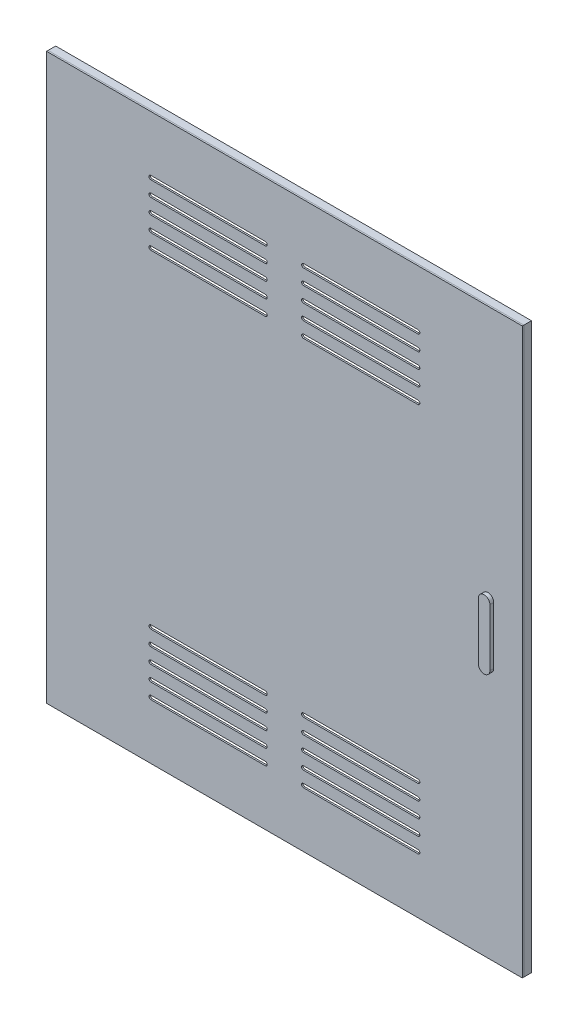
from build123d import *

# Parameters (mm, degrees)
SKETCH1_W            = 1247
SKETCH1_H            = 1480
SKETCH1_W_2          = 1207
SKETCH1_H_2          = 1440
BOSS_EXTRUDE1_DEPTH  = 20
SKETCH3_W            = 20
SKETCH3_H            = 60
BOSS_EXTRUDE2_DEPTH  = 2
SKETCH4_R            = 7
SKETCH4_R_2          = 5
BOSS_EXTRUDE3_DEPTH  = 60
SKETCH5_W            = 1247
SKETCH5_H            = 1480
BOSS_EXTRUDE4_DEPTH  = 4
BOSS_EXTRUDE5_DEPTH  = 10
CUT_EXTRUDE1_DEPTH   = 978.224257783
LPATTERN1_COUNT      = 5
LPATTERN1_PITCH      = 40
MIRROR2_COPY_1_DEPTH = 978.224257783
MIRROR2_COPY_2_DEPTH = 978.224257783
MIRROR2_COPY_3_DEPTH = 978.224257783
MIRROR2_COPY_4_DEPTH = 978.224257783


with BuildPart() as part:
    # Sketch1 → Boss-Extrude1 (new body)
    with BuildSketch(Plane.XY):
        Rectangle(SKETCH1_W, SKETCH1_H)
        Rectangle(SKETCH1_W_2, SKETCH1_H_2, mode=Mode.SUBTRACT)
    extrude(amount=BOSS_EXTRUDE1_DEPTH)

    # Sketch3 → Boss-Extrude2 (add)
    with BuildSketch(Plane.ZY.offset(623.5)):
        with Locations((10, 530)):
            Rectangle(SKETCH3_W, SKETCH3_H)
    boss_extrude2 = extrude(amount=BOSS_EXTRUDE2_DEPTH)

    # Sketch4 → Boss-Extrude3 (add)
    with BuildSketch(Plane(origin=(0, 560, 0), x_dir=(1, 0, 0), z_dir=(0, 1, 0))):
        with Locations((-630.5, 0)):
            Circle(SKETCH4_R)
        with Locations(Location((-630.5, 0, 0), (0, 0, 180))):
            Circle(SKETCH4_R_2, mode=Mode.SUBTRACT)
    boss_extrude3 = extrude(amount=-BOSS_EXTRUDE3_DEPTH)

    # Mirror1: Boss-Extrude2, Boss-Extrude3 across plane
    add(boss_extrude2.mirror(Plane.ZX))
    add(boss_extrude3.mirror(Plane.ZX))


with BuildPart() as body_2:
    # Sketch5 → Boss-Extrude4 (new body)
    with BuildSketch(Plane.XY.offset(20)):
        Rectangle(SKETCH5_W, SKETCH5_H)
    extrude(amount=BOSS_EXTRUDE4_DEPTH)

    # Sketch6 → Boss-Extrude5 (add)
    with BuildSketch(Plane.XY.offset(24)):
        with BuildLine():
            Line((548.5, 75), (548.5, -75))
            ThreePointArc((548.5, -75), (533.5, -90), (518.5, -75))
            Line((518.5, -75), (518.5, 75))
            ThreePointArc((518.5, 75), (533.5, 90), (548.5, 75))
        make_face()
    extrude(amount=BOSS_EXTRUDE5_DEPTH)

    # Sketch7 → Cut-Extrude1 (cut, through all)
    with BuildSketch(Plane.XY.offset(24)):
        with BuildLine():
            Line((-350, 595), (-50, 595))
            ThreePointArc((-50, 595), (-45, 590), (-50, 585))
            Line((-50, 585), (-350, 585))
            ThreePointArc((-350, 585), (-355, 590), (-350, 595))
        make_face()
        with BuildLine():
            Line((50, 595), (350, 595))
            ThreePointArc((350, 595), (355, 590), (350, 585))
            Line((350, 585), (50, 585))
            ThreePointArc((50, 585), (45, 590), (50, 595))
        make_face()
    cut_extrude1 = extrude(amount=-CUT_EXTRUDE1_DEPTH, mode=Mode.SUBTRACT)

    # LPattern1: Cut-Extrude1 ×5
    with Locations(*[(0, -i * LPATTERN1_PITCH, 0) for i in range(1, LPATTERN1_COUNT)]):
        add(cut_extrude1, mode=Mode.SUBTRACT)

    # Mirror2: Cut-Extrude1 across plane
    add(cut_extrude1.mirror(Plane.ZX), mode=Mode.SUBTRACT)

    # Mirror2 copy 1 sketch → Mirror2 copy 1 (cut, through all)
    with BuildSketch(Plane(origin=(0, 40, 24), x_dir=(1, 0, 0), z_dir=(0, 0, 1))):
        with BuildLine():
            Line((-350, -595), (-50, -595))
            ThreePointArc((-50, -595), (-45, -590), (-50, -585))
            Line((-50, -585), (-350, -585))
            ThreePointArc((-350, -585), (-355, -590), (-350, -595))
        make_face()
        with BuildLine():
            Line((50, -595), (350, -595))
            ThreePointArc((350, -595), (355, -590), (350, -585))
            Line((350, -585), (50, -585))
            ThreePointArc((50, -585), (45, -590), (50, -595))
        make_face()
    extrude(amount=-MIRROR2_COPY_1_DEPTH, mode=Mode.SUBTRACT)

    # Mirror2 copy 2 sketch → Mirror2 copy 2 (cut, through all)
    with BuildSketch(Plane(origin=(0, 80, 24), x_dir=(1, 0, 0), z_dir=(0, 0, 1))):
        with BuildLine():
            Line((-350, -595), (-50, -595))
            ThreePointArc((-50, -595), (-45, -590), (-50, -585))
            Line((-50, -585), (-350, -585))
            ThreePointArc((-350, -585), (-355, -590), (-350, -595))
        make_face()
        with BuildLine():
            Line((50, -595), (350, -595))
            ThreePointArc((350, -595), (355, -590), (350, -585))
            Line((350, -585), (50, -585))
            ThreePointArc((50, -585), (45, -590), (50, -595))
        make_face()
    extrude(amount=-MIRROR2_COPY_2_DEPTH, mode=Mode.SUBTRACT)

    # Mirror2 copy 3 sketch → Mirror2 copy 3 (cut, through all)
    with BuildSketch(Plane(origin=(0, 120, 24), x_dir=(1, 0, 0), z_dir=(0, 0, 1))):
        with BuildLine():
            Line((-350, -595), (-50, -595))
            ThreePointArc((-50, -595), (-45, -590), (-50, -585))
            Line((-50, -585), (-350, -585))
            ThreePointArc((-350, -585), (-355, -590), (-350, -595))
        make_face()
        with BuildLine():
            Line((50, -595), (350, -595))
            ThreePointArc((350, -595), (355, -590), (350, -585))
            Line((350, -585), (50, -585))
            ThreePointArc((50, -585), (45, -590), (50, -595))
        make_face()
    extrude(amount=-MIRROR2_COPY_3_DEPTH, mode=Mode.SUBTRACT)

    # Mirror2 copy 4 sketch → Mirror2 copy 4 (cut, through all)
    with BuildSketch(Plane(origin=(0, 160, 24), x_dir=(1, 0, 0), z_dir=(0, 0, 1))):
        with BuildLine():
            Line((-350, -595), (-50, -595))
            ThreePointArc((-50, -595), (-45, -590), (-50, -585))
            Line((-50, -585), (-350, -585))
            ThreePointArc((-350, -585), (-355, -590), (-350, -595))
        make_face()
        with BuildLine():
            Line((50, -595), (350, -595))
            ThreePointArc((350, -595), (355, -590), (350, -585))
            Line((350, -585), (50, -585))
            ThreePointArc((50, -585), (45, -590), (50, -595))
        make_face()
    extrude(amount=-MIRROR2_COPY_4_DEPTH, mode=Mode.SUBTRACT)


solid = Compound([part.part, body_2.part])
